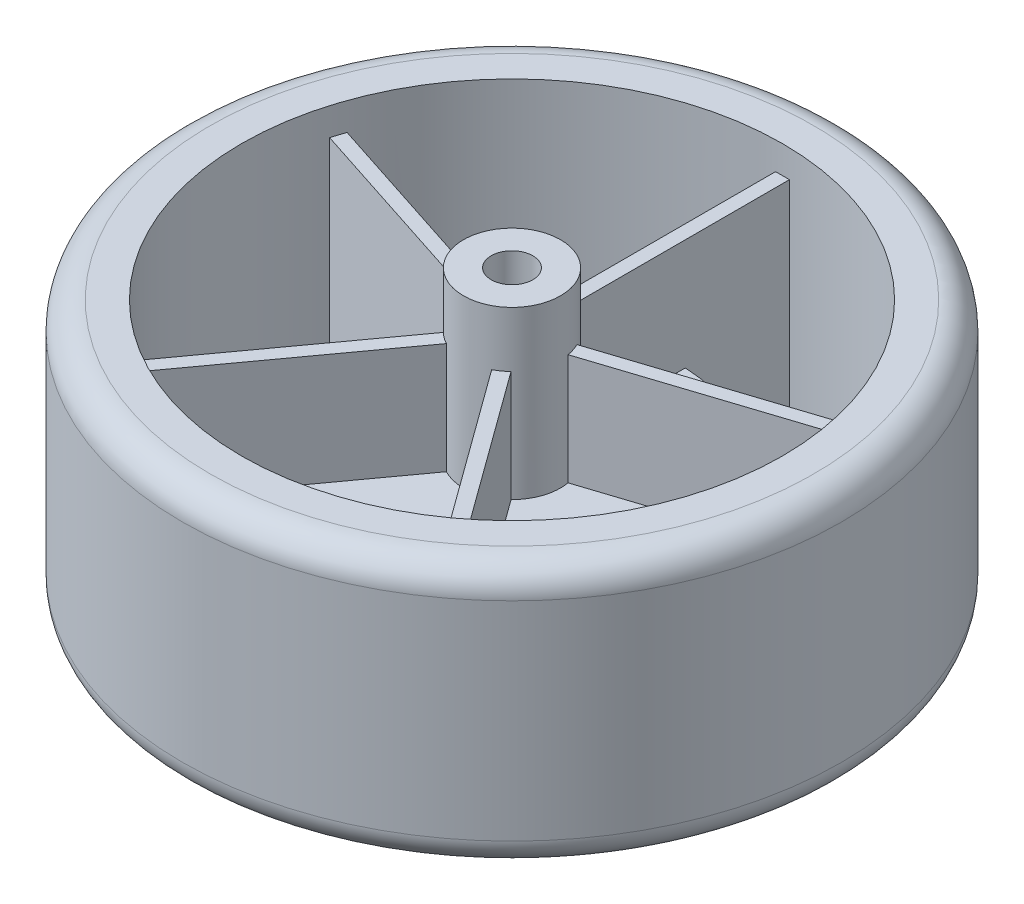
from build123d import *

# Parameters (mm, degrees)
SKETCH_2_R               = 5
EXTRUDE_1_DEPTH          = 5
SKETCH_3_R               = 12
EXTRUDE_2_DEPTH          = 2
SKETCH_5_R               = 3.5
SKETCH_5_R_2             = 1.5
EXTRUDE_3_DEPTH          = 12
EXTRUDE_4_DEPTH          = 15
PATTERN_CIRCULAR_1_COUNT = 5
CUT_EXTRUDE_START        = -15
CUT_EXTRUDE_1_DEPTH      = 15
PATTERN_CIRCULAR_2_COUNT = 5


with BuildPart() as part:
    # 草图1 → 旋转1 (revolve)
    with BuildSketch(Plane.XY, mode=Mode.PRIVATE) as revolve_1_sk:
        with BuildLine():
            Line((19.5, 9.5), (19.5, -7.5))
            Line((19.5, -7.5), (0, -7.5))
            Line((0, -7.5), (0, -9.5))
            Line((0, -9.5), (21.75, -9.5))
            ThreePointArc((21.75, -9.5), (23.164213562, -8.914213562), (23.75, -7.5))
            Line((23.75, -7.5), (23.75, 7.5))
            ThreePointArc((23.75, 7.5), (23.164213562, 8.914213562), (21.75, 9.5))
            Line((21.75, 9.5), (19.5, 9.5))
        make_face()
    revolve(revolve_1_sk.sketch.rotate(Axis((0, 0, 0), (0, -1, 0)), 90), axis=Axis((0, 0, 0), (0, -1, 0)))

    # 草图2 → 凸台-拉伸1 (add)
    with BuildSketch(Plane(origin=(0, -7.5, 0), x_dir=(1, 0, 0), z_dir=(0, 1, 0))):
        with Locations(Location((0, 0, 0), (0, 0, 90))):
            Circle(SKETCH_2_R)
    extrude(amount=EXTRUDE_1_DEPTH)

    # 草图3 → 凸台-拉伸2 (add)
    with BuildSketch(Plane(origin=(0, -2.5, 0), x_dir=(1, 0, 0), z_dir=(0, 1, 0))):
        with Locations(Location((0, 0, 0), (0, 0, 270))):
            Circle(SKETCH_3_R)
    extrude(amount=EXTRUDE_2_DEPTH)

    # 草图5 → 凸台-拉伸3 (add)
    with BuildSketch(Plane(origin=(0, -0.5, 0), x_dir=(1, 0, 0), z_dir=(0, 1, 0))):
        with Locations(Location((0, 0, 0), (0, 0, 270))):
            Circle(SKETCH_5_R)
        with Locations(Location((0, 0, 0), (0, 0, 270))):
            Circle(SKETCH_5_R_2, mode=Mode.SUBTRACT)
    extrude(amount=EXTRUDE_3_DEPTH)

    # 草图6 → 凸台-拉伸4 (add)
    with BuildSketch(Plane(origin=(0, -7.5, 0), x_dir=(1, 0, 0), z_dir=(0, 1, 0))):
        with BuildLine():
            Line((-0.5, 19.49358869), (-0.5, 3.464101615))
            ThreePointArc((-0.5, 3.464101615), (0, 3.5), (0.5, 3.464101615))
            Line((0.5, 3.464101615), (0.5, 19.49358869))
            ThreePointArc((0.5, 19.49358869), (0, 19.5), (-0.5, 19.49358869))
        make_face()
    extrude_4 = extrude(amount=EXTRUDE_4_DEPTH)

    # 阵列(圆周)1: 凸台-拉伸4 ×5 about axis
    pattern_circular_1_axis = Axis((0, 0, 0), (0, 1, 0))
    for i in range(1, PATTERN_CIRCULAR_1_COUNT):
        add(extrude_4.rotate(pattern_circular_1_axis, i * 360 / PATTERN_CIRCULAR_1_COUNT))

    # 草图7 → 切除-拉伸1 (cut)
    with BuildSketch(Plane(origin=(0, -7.5, 0), x_dir=(1, 0, 0), z_dir=(0, 1, 0)).offset(CUT_EXTRUDE_START)):
        with BuildLine():
            Line((1.254341559, 11.934262744), (1.567926949, 14.917828431))
            ThreePointArc((1.567926949, 14.917828431), (8.816778784, 12.135254916), (13.703181865, 6.101049646))
            Line((13.703181865, 6.101049646), (10.962545492, 4.880839717))
            ThreePointArc((10.962545492, 4.880839717), (7.053423028, 9.708203932), (1.254341559, 11.934262744))
        make_face()
    cut_extrude_1 = extrude(amount=CUT_EXTRUDE_1_DEPTH, mode=Mode.SUBTRACT)

    # 阵列(圆周)2: 切除-拉伸1 ×5 about axis
    pattern_circular_2_axis = Axis((0, 0, 0), (0, 1, 0))
    for i in range(1, PATTERN_CIRCULAR_2_COUNT):
        add(cut_extrude_1.rotate(pattern_circular_2_axis, i * 360 / PATTERN_CIRCULAR_2_COUNT), mode=Mode.SUBTRACT)


solid = part.part
